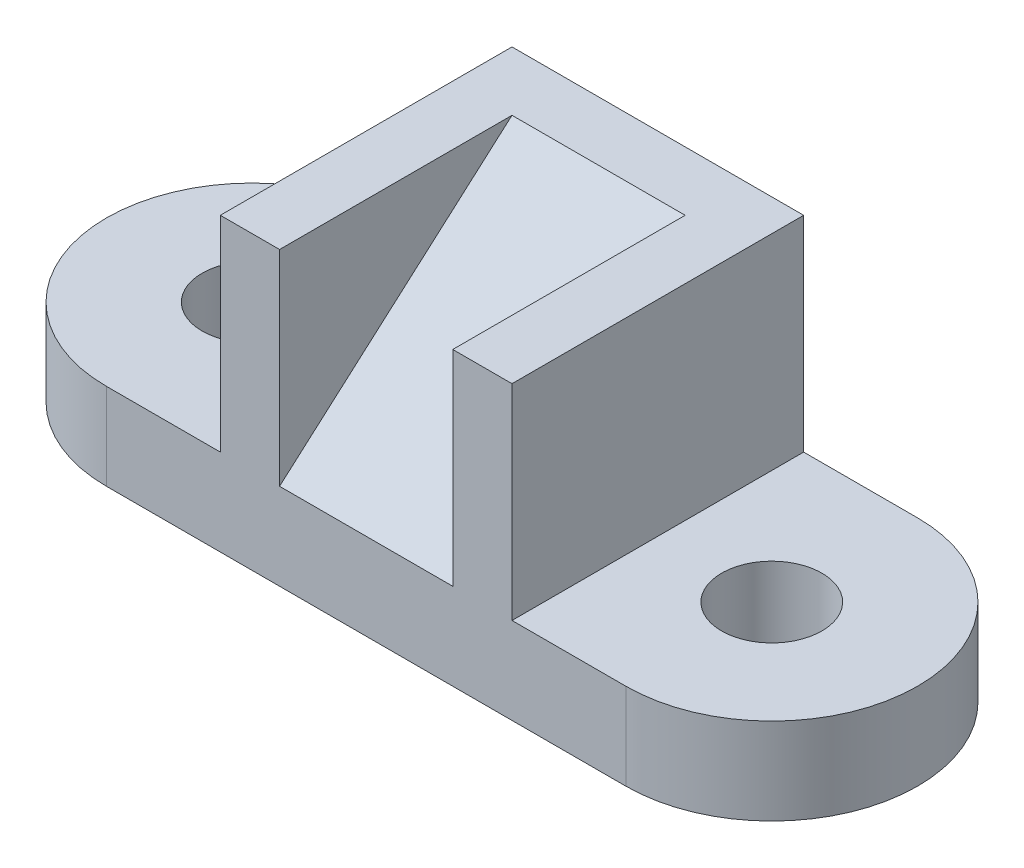
from build123d import *

# Parameters (mm, degrees)
BOSS_EXTRUDE1_DEPTH      = 19
SKETCH8_R                = 11
CUT_EXTRUDE12_DEPTH      = 19
BOSS_EXTRUDE3_DEPTH      = 32
BOSS_EXTRUDE3_DEPTH_BACK = 32
SKETCH9_W                = 64
SKETCH9_H                = 64
CUT_EXTRUDE13_DEPTH      = 19


with BuildPart() as part:
    # Sketch1 → Boss-Extrude1 (new body)
    with BuildSketch(Plane(origin=(0, 0, 0), x_dir=(1, 0, 0), z_dir=(0, 1, 0))):
        with BuildLine():
            Line((-57, 32), (57, 32))
            ThreePointArc((57, 32), (89, 0), (57, -32))
            Line((57, -32), (-57, -32))
            ThreePointArc((-57, -32), (-89, 0), (-57, 32))
        make_face()
    extrude(amount=BOSS_EXTRUDE1_DEPTH)

    # Sketch8 → Cut-Extrude12 (cut, symmetric)
    with BuildSketch(Plane(origin=(0, 19, 0), x_dir=(1, 0, 0), z_dir=(0, 1, 0))):
        with Locations((-57, 0)):
            Circle(SKETCH8_R)
        with Locations((57, 0)):
            Circle(SKETCH8_R)
    extrude(amount=CUT_EXTRUDE12_DEPTH, both=True, mode=Mode.SUBTRACT)

    # Sketch9 → Boss-Extrude3 (add, two sides: drawn at the far end of the back side and taken through both)
    with BuildSketch(Plane(origin=(0, 0, 0), x_dir=(0, 0, -1), z_dir=(1, 0, 0)).offset(-BOSS_EXTRUDE3_DEPTH_BACK)):
        with Locations((0, 32)):
            Rectangle(SKETCH9_W, SKETCH9_H)
    extrude(amount=BOSS_EXTRUDE3_DEPTH + BOSS_EXTRUDE3_DEPTH_BACK)

    # Sketch10 → Cut-Extrude13 (cut, symmetric)
    with BuildSketch(Plane(origin=(0, 0, 0), x_dir=(0, 0, -1), z_dir=(1, 0, 0))):
        Polygon((-32, 19), (19, 64), (-32, 64), align=None)
    extrude(amount=CUT_EXTRUDE13_DEPTH, both=True, mode=Mode.SUBTRACT)


solid = part.part
